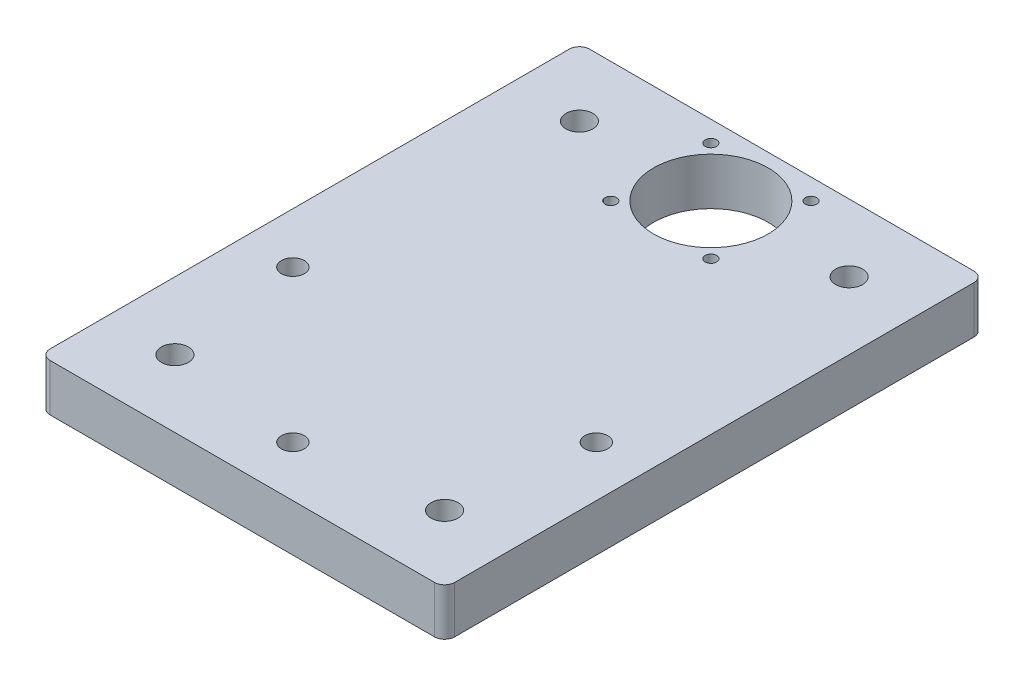
from build123d import *

# Parameters (mm, degrees)
EXTRUDE_1_DEPTH     = 14
SKETCH_3_R          = 1.7
CUT_EXTRUDE_1_DEPTH = 118.45637488
SKETCH_4_R          = 3.4
CUT_EXTRUDE_2_DEPTH = 118.45637488
SKETCH_5_R          = 16.999999997
CUT_EXTRUDE_3_DEPTH = 118.45637488
SKETCH_6_R          = 4
CUT_EXTRUDE_4_DEPTH = 118.45637488


with BuildPart() as part:
    # 草图1 → 凸台-拉伸1 (new body)
    with BuildSketch(Plane(origin=(0, 0, 0), x_dir=(1, 0, 0), z_dir=(0, 1, 0))):
        with BuildLine():
            Line((-57, -100), (57, -100))
            ThreePointArc((57, -100), (59.121320344, -99.121320344), (60, -97))
            Line((60, -97), (60, 57))
            ThreePointArc((60, 57), (59.121320344, 59.121320344), (57, 60))
            Line((57, 60), (-57, 60))
            ThreePointArc((-57, 60), (-59.121320344, 59.121320344), (-60, 57))
            Line((-60, 57), (-60, -97))
            ThreePointArc((-60, -97), (-59.121320344, -99.121320344), (-57, -100))
        make_face()
    extrude(amount=EXTRUDE_1_DEPTH)

    # 草图3 → 切除-拉伸1 (cut, through all)
    with BuildSketch(Plane.XZ):
        with Locations(Location((14.849242405, -24.150757595, 0), (0, 0, 270))):
            Circle(SKETCH_3_R)
        with Locations(Location((14.849242405, -53.849242405, 0), (0, 0, 270))):
            Circle(SKETCH_3_R)
        with Locations(Location((-14.849242405, -53.849242405, 0), (0, 0, 270))):
            Circle(SKETCH_3_R)
        with Locations(Location((-14.849242405, -24.150757595, 0), (0, 0, 270))):
            Circle(SKETCH_3_R)
    extrude(amount=-CUT_EXTRUDE_1_DEPTH, mode=Mode.SUBTRACT)

    # 草图4 → 切除-拉伸2 (cut, through all)
    with BuildSketch(Plane.XZ):
        with Locations(Location((0, 85, 0), (0, 0, 270))):
            Circle(SKETCH_4_R)
        with Locations(Location((45, 40, 0), (0, 0, 270))):
            Circle(SKETCH_4_R)
        with Locations(Location((-45, 40, 0), (0, 0, 270))):
            Circle(SKETCH_4_R)
    extrude(amount=-CUT_EXTRUDE_2_DEPTH, mode=Mode.SUBTRACT)

    # 草图5 → 切除-拉伸3 (cut, through all)
    with BuildSketch(Plane(origin=(0, 14, 0), x_dir=(1, 0, 0), z_dir=(0, 1, 0))):
        with Locations(Location((4e-09, 38.999999996, 0), (0, 0, 270))):
            Circle(SKETCH_5_R)
    extrude(amount=-CUT_EXTRUDE_3_DEPTH, mode=Mode.SUBTRACT)

    # 草图6 → 切除-拉伸4 (cut, through all)
    with BuildSketch(Plane.XZ):
        with Locations(Location((40, 80, 0), (0, 0, 270))):
            Circle(SKETCH_6_R)
        with Locations(Location((-40, 80, 0), (0, 0, 90))):
            Circle(SKETCH_6_R)
        with Locations(Location((40, -40, 0), (0, 0, 90))):
            Circle(SKETCH_6_R)
        with Locations(Location((-40, -40, 0), (0, 0, 270))):
            Circle(SKETCH_6_R)
    extrude(amount=-CUT_EXTRUDE_4_DEPTH, mode=Mode.SUBTRACT)


solid = part.part
